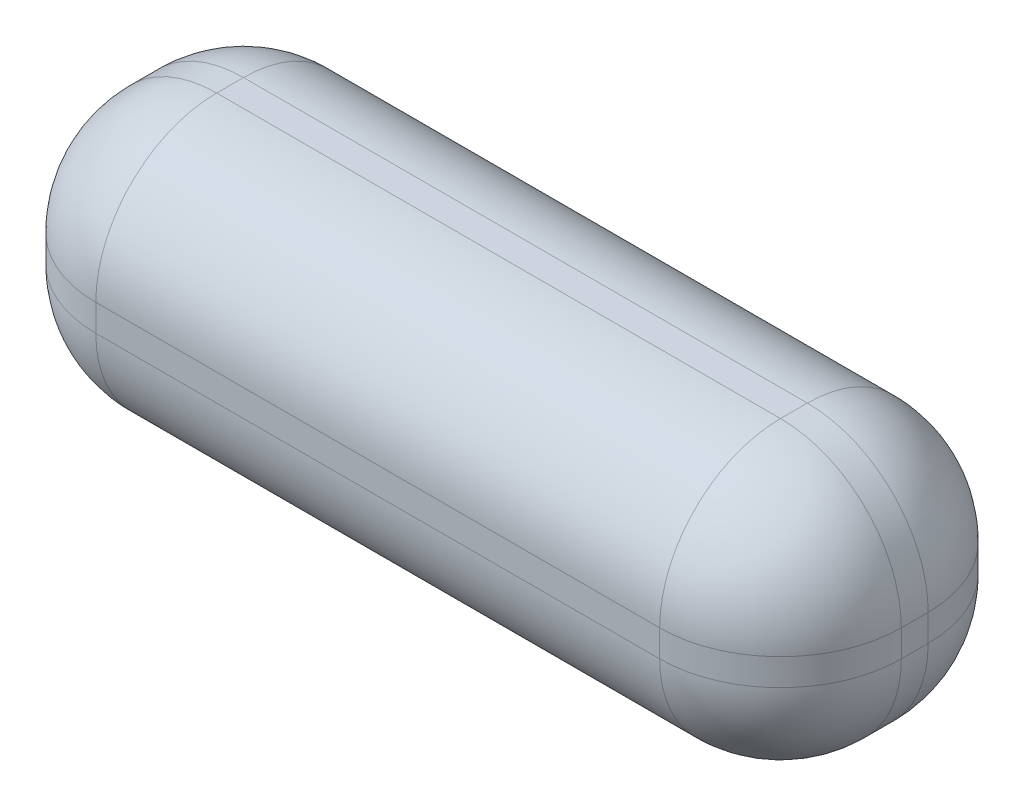
from build123d import *

# Parameters (mm, degrees)
SKETCH1_W           = 300
SKETCH1_H           = 100
BOSS_EXTRUDE1_DEPTH = 50
FILLET1_R           = 45


with BuildPart() as part:
    # Sketch1 → Boss-Extrude1 (new, symmetric)
    with BuildSketch(Plane.XY):
        Rectangle(SKETCH1_W, SKETCH1_H)
    extrude(amount=BOSS_EXTRUDE1_DEPTH, both=True)

    # Fillet1
    fillet1_edges = [part.edges().sort_by_distance(p)[0] for p in [
        (150, 0, 50),
        (0, 50, 50),
        (-150, 0, 50),
        (0, 50, -50),
        (150, 0, -50),
        (0, -50, -50),
        (-150, 0, -50),
        (-150, 50, 0),
        (150, 50, 0),
        (150, -50, 0),
        (-150, -50, 0),
        (0, -50, 50),
    ]]
    fillet(fillet1_edges, radius=FILLET1_R)


solid = part.part
